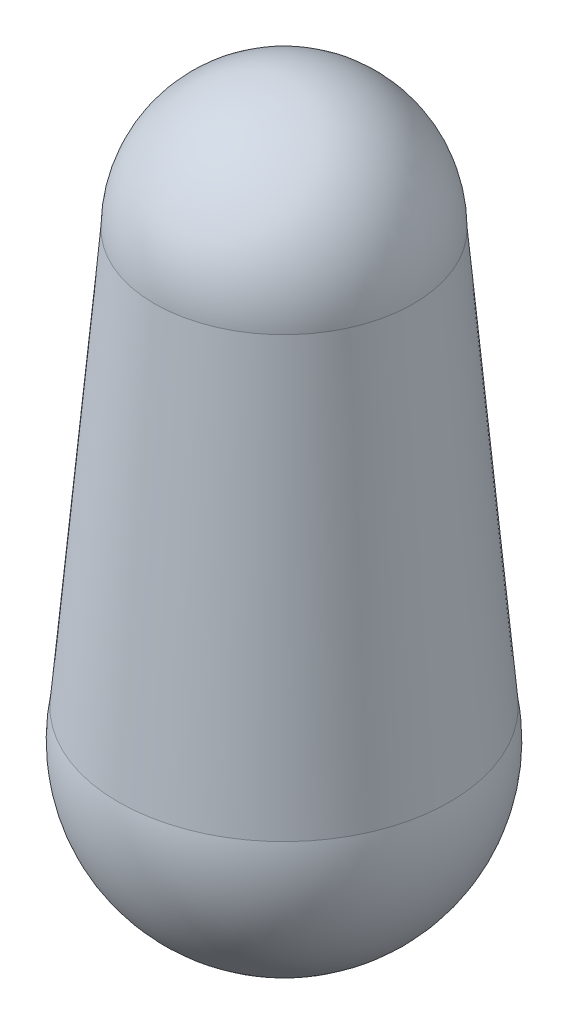
from build123d import *

# Parameters (mm, degrees)
SKETCH2_R           = 3.8
BOSS_EXTRUDE1_DEPTH = 10
BOSS_EXTRUDE1_TAPER = 5


with BuildPart() as part:
    # Sketch1 → Revolve1 (revolve)
    with BuildSketch(Plane(origin=(0, 0, 0), x_dir=(1, 0, 0), z_dir=(0, 1, 0))):
        with BuildLine():
            Line((0, 3.8), (0, -3.8))
            ThreePointArc((0, -3.8), (3.8, 0), (0, 3.8))
        make_face()
    revolve(axis=Axis((0, 0, -3.8), (0, 0, 1)))

    # Sketch2 → Boss-Extrude1 (add)
    with BuildSketch(Plane(origin=(0, 0, 0), x_dir=(1, 0, 0), z_dir=(0, 1, 0))):
        Circle(SKETCH2_R)
    extrude(amount=BOSS_EXTRUDE1_DEPTH, taper=BOSS_EXTRUDE1_TAPER)

    # Sketch3 → Revolve2 (revolve)
    with BuildSketch(Plane(origin=(0, 10, 0), x_dir=(1, 0, 0), z_dir=(0, 1, 0))):
        with BuildLine():
            Line((0, 2.925113365), (0, -2.925113365))
            ThreePointArc((0, -2.925113365), (2.925113365, 0), (0, 2.925113365))
        make_face()
    revolve(axis=Axis((0, 10, -2.925113365), (0, 0, 1)))


solid = part.part
